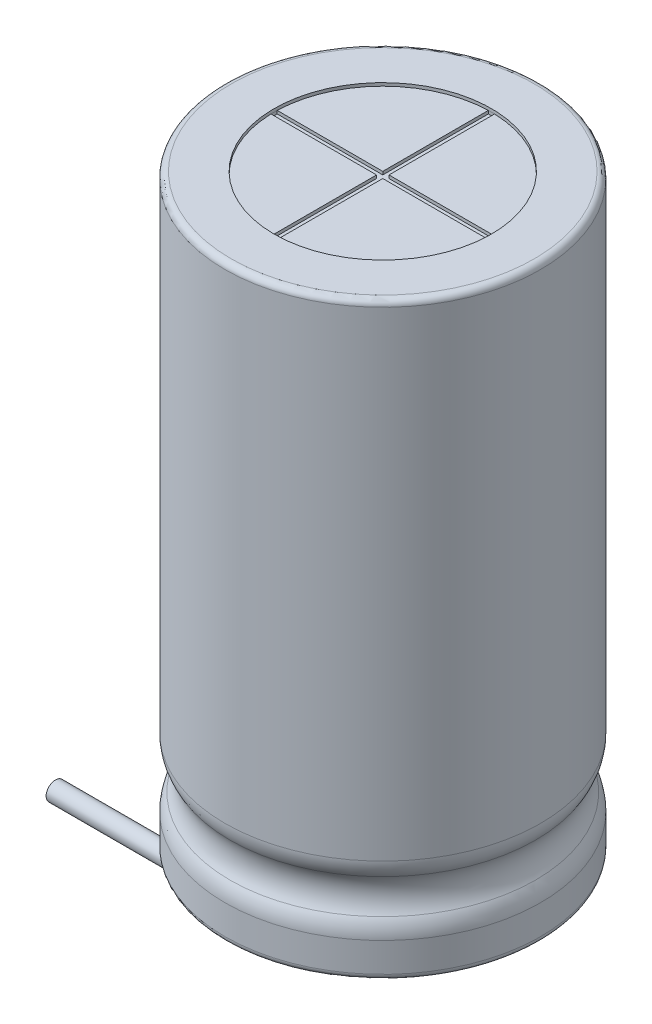
from build123d import *

# Parameters (mm, degrees)
SZKIC2_R                   = 3.5
WYTNIJ_WYCI_GNI_CIE1_DEPTH = 0.1
SZKIC3_W                   = 0.2
SZKIC3_H                   = 3.5
WYTNIJ_WYCI_GNI_CIE2_DEPTH = 0.1
SZYK_KO_OWY1_COUNT         = 4
WYTNIJ_WYCI_GNI_CIE3_START = -0.6
SZKIC4_R                   = 3.5
WYTNIJ_WYCI_GNI_CIE3_DEPTH = 0.6
SZKIC7_2_R                 = 0.3


with BuildPart() as part:
    # Szkic1 → Obrót1 (revolve)
    with BuildSketch(Plane(origin=(0, 0, 0), x_dir=(0, 0, -1), z_dir=(1, 0, 0))):
        with BuildLine():
            Line((0, 0), (4.88, 0))
            ThreePointArc((4.88, 0), (5.021421356, 0.058578644), (5.08, 0.2))
            Line((5.08, 0.2), (5.08, 1.143679374))
            ThreePointArc((5.08, 1.143679374), (5.038185781, 1.430146031), (4.916232342, 1.692708278))
            ThreePointArc((4.916232342, 1.692708278), (4.75, 2.25), (4.916232342, 2.807291722))
            ThreePointArc((4.916232342, 2.807291722), (5.038185781, 3.069853969), (5.08, 3.356320626))
            Line((5.08, 3.356320626), (5.08, 18.8))
            ThreePointArc((5.08, 18.8), (5.021421356, 18.941421356), (4.88, 19))
            Line((4.88, 19), (0, 19))
            Line((0, 19), (0, 0))
        make_face()
    revolve(axis=Axis((0, 19, 0), (0, -1, 0)))

    # Szkic2 → Wytnij-wyciągnięcie1 (cut)
    with BuildSketch(Plane(origin=(0, 19, 0), x_dir=(1, 0, 0), z_dir=(0, 1, 0))):
        Circle(SZKIC2_R)
    extrude(amount=-WYTNIJ_WYCI_GNI_CIE1_DEPTH, mode=Mode.SUBTRACT)

    # Szkic3 → Wytnij-wyciągnięcie2 (cut)
    with BuildSketch(Plane(origin=(0, 18.9, 0), x_dir=(1, 0, 0), z_dir=(0, 1, 0))):
        with Locations((0, 1.75)):
            Rectangle(SZKIC3_W, SZKIC3_H)
    wytnij_wyci_gni_cie2 = extrude(amount=-WYTNIJ_WYCI_GNI_CIE2_DEPTH, mode=Mode.SUBTRACT)

    # Szyk kołowy1: Wytnij-wyciągnięcie2 ×4 about axis
    szyk_ko_owy1_axis = Axis((0, 0, 0), (0, 1, 0))
    for i in range(1, SZYK_KO_OWY1_COUNT):
        add(wytnij_wyci_gni_cie2.rotate(szyk_ko_owy1_axis, i * 360 / SZYK_KO_OWY1_COUNT), mode=Mode.SUBTRACT)

    # Szkic4 → Wytnij-wyciągnięcie3 (cut)
    with BuildSketch(Plane.XZ.offset(WYTNIJ_WYCI_GNI_CIE3_START)):
        Circle(SZKIC4_R)
    extrude(amount=WYTNIJ_WYCI_GNI_CIE3_DEPTH, mode=Mode.SUBTRACT)

    # По траектории1: sweep along a path in Эскиз1
    with BuildLine(Plane.XY) as sweep_1_path:
        Line((0, 0.6), (0, 0))
        ThreePointArc((0, 0), (-0.292893219, -0.707106781), (-1, -1))
        Line((-1, -1), (-8, -1))
    # Szkic7<2> → По траектории1 (sweep)
    with BuildSketch(Plane(origin=(0, 0.6, 0), x_dir=(-1, 0, 0), z_dir=(0, -1, 0))):
        with Locations((0, -2.54)):
            Circle(SZKIC7_2_R)
        with Locations((0, 2.54)):
            Circle(SZKIC7_2_R)
    sweep(path=sweep_1_path.line)


solid = part.part
